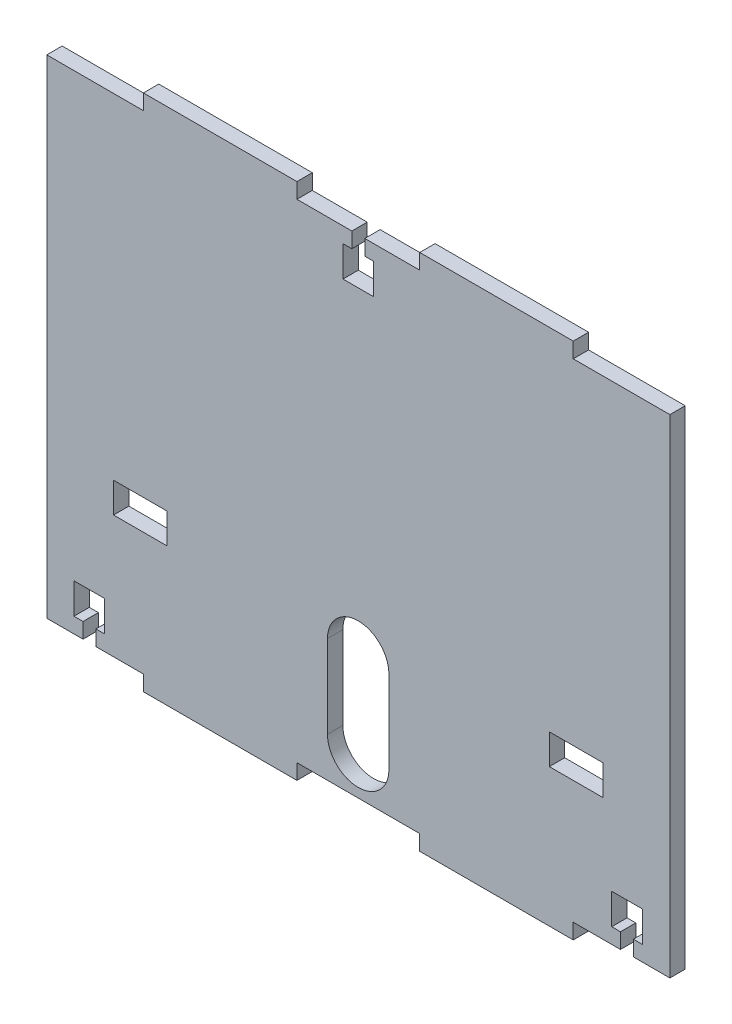
from build123d import *

# Parameters (mm, degrees)
ESQUISSE1_W        = 17.426618769
ESQUISSE1_H        = 9.816495883
BOSS_EXTRU_2_DEPTH = 5


with BuildPart() as part:
    # Esquisse1 → Boss.-Extru.2 (new body)
    with BuildSketch(Plane.XY):
        Polygon((-179.357380563, 206.271549111), (-179.357380563, 47.351549111), (-167.551475198, 47.351549111), (-167.551475198, 52.351549111), (-170.511475198, 52.351549111), (-170.511475198, 62.351549111), (-160.511475198, 62.351549111), (-160.511475198, 52.351549111), (-163.351475198, 52.351549111), (-163.351475198, 47.351549111), (-161.517380563, 47.351549111), (-147.887380563, 47.351549111), (-147.887380563, 42.351549111), (-97.887380563, 42.351549111), (-97.887380563, 47.351549111), (-79.987380563, 47.351549111), (-73.667421864, 47.351549111), (-57.887380563, 47.351549111), (-57.887380563, 42.351549111), (-7.887380563, 42.351549111), (-7.887380563, 47.351549111), (7.492660738, 47.351549111), (7.492660738, 52.351549111), (4.652660738, 52.351549111), (4.652660738, 62.351549111), (14.652660738, 62.351549111), (14.652660738, 52.351549111), (11.692660738, 52.351549111), (11.692660738, 47.351549111), (18.012619437, 47.351549111), (23.582619437, 47.351549111), (23.582619437, 206.271549111), (-7.887380563, 206.271549111), (-7.887380563, 211.271549111), (-57.887380563, 211.271549111), (-57.887380563, 206.271549111), (-73.667421864, 206.271549111), (-75.787380563, 206.271549111), (-75.787380563, 201.271549111), (-72.887380563, 201.271549111), (-72.887380563, 191.271549111), (-82.887380563, 191.271549111), (-82.887380563, 201.271549111), (-79.987380563, 201.271549111), (-79.987380563, 206.271549111), (-97.887380563, 206.271549111), (-97.887380563, 211.271549111), (-147.887380563, 211.271549111), (-147.887380563, 206.271549111), align=None)
        with BuildLine():
            Line((-87.92940723, 60.351549111), (-87.92940723, 87.351549111))
            ThreePointArc((-87.92940723, 87.351549111), (-77.92940723, 97.351549111), (-67.92940723, 87.351549111))
            Line((-67.92940723, 87.351549111), (-67.92940723, 60.351549111))
            ThreePointArc((-67.92940723, 60.351549111), (-77.92940723, 50.351549111), (-87.92940723, 60.351549111))
        make_face(mode=Mode.SUBTRACT)
        with Locations((-6.955391392, 92.259797053)):
            Rectangle(ESQUISSE1_W, ESQUISSE1_H, mode=Mode.SUBTRACT)
        with Locations((-148.903423068, 92.259797053)):
            Rectangle(ESQUISSE1_W, ESQUISSE1_H, mode=Mode.SUBTRACT)
    extrude(amount=BOSS_EXTRU_2_DEPTH)


solid = part.part
